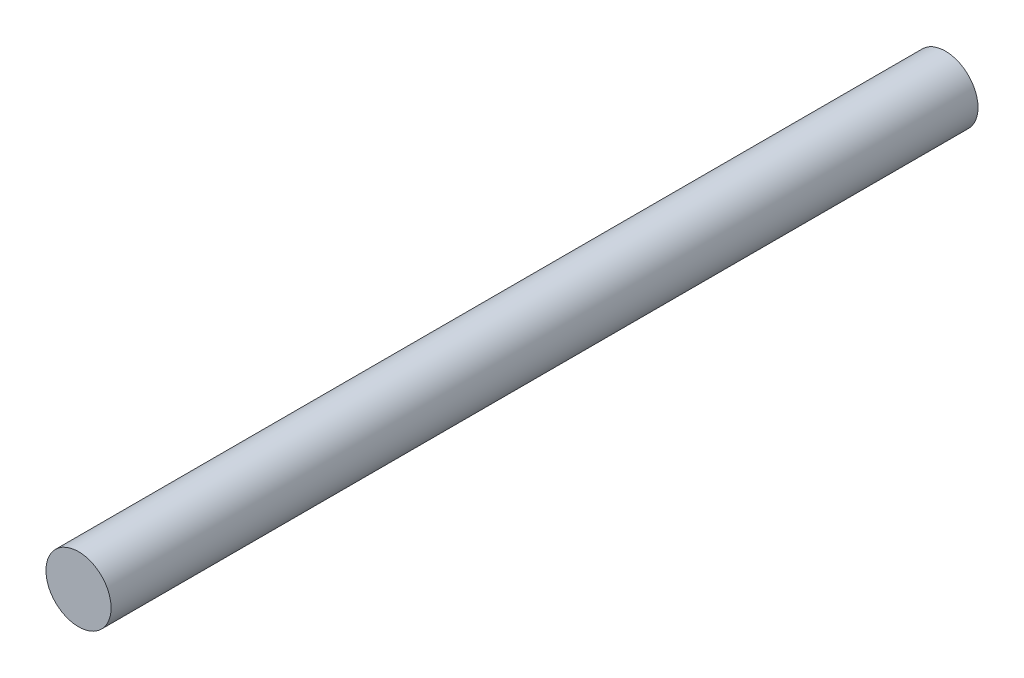
from build123d import *

# Parameters (mm, degrees)
SKETCH1_R           = 3.25
BOSS_EXTRUDE1_DEPTH = 86.5


with BuildPart() as part:
    # Sketch1 → Boss-Extrude1 (new body)
    with BuildSketch(Plane.XY):
        with Locations((0.052288579, 0.183010026)):
            Circle(SKETCH1_R)
    extrude(amount=BOSS_EXTRUDE1_DEPTH)


solid = part.part
